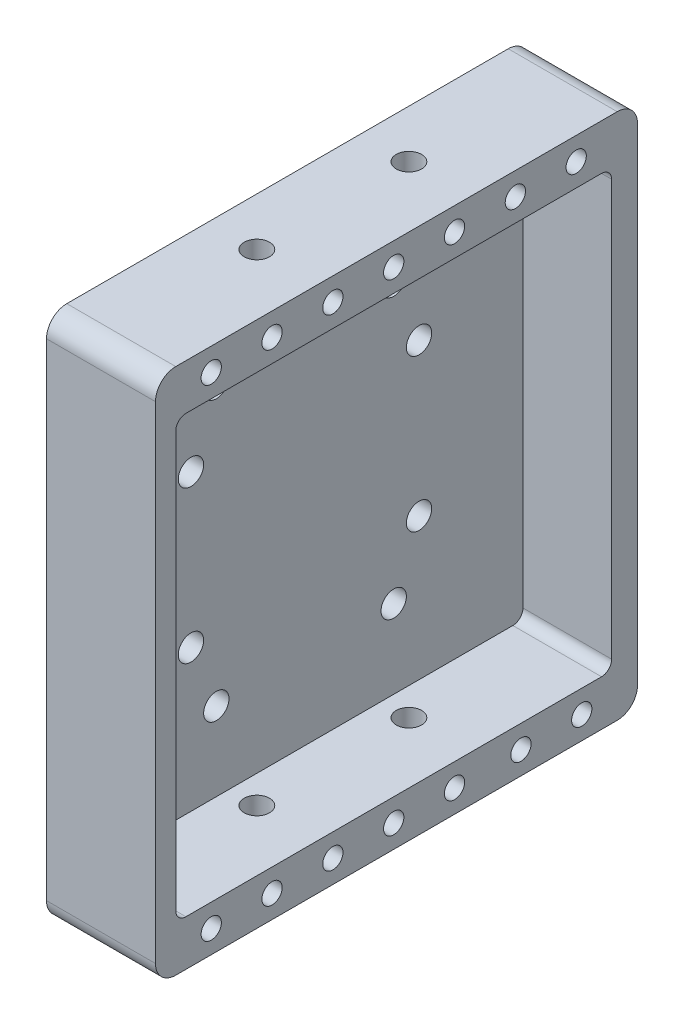
from build123d import *

# Parameters (mm, degrees)
SKETCH_1_W                = 104
SKETCH_1_H                = 95.096423431
EXTRUDE_1_DEPTH           = 21.5
SKETCH_2_W                = 86
SKETCH_2_H                = 86
CUT_EXTRUDE_1_DEPTH       = 17.5
HOLE_WIZARD_4_0_4_1_D     = 4
HOLE_WIZARD_4_0_4_1_DEPTH = 8
HOLE_WIZARD_5_0_5_1_D     = 5
HOLE_WIZARD_5_0_5_1_DEPTH = 9
HOLE_WIZARD_5_0_5_2_D     = 5
HOLE_WIZARD_5_0_5_2_DEPTH = 21.5
HOLE_WIZARD_5_0_5_3_D     = 5
HOLE_WIZARD_5_0_5_3_DEPTH = 104
FILLET_1_R                = 2
FILLET_2_R                = 4


with BuildPart() as part:
    # 草图1 → 凸台-拉伸1 (new body)
    with BuildSketch(Plane(origin=(0, 0, 0), x_dir=(0, -1, 0), z_dir=(-1, 0, 0))):
        with Locations((0, -0.548211716)):
            Rectangle(SKETCH_1_W, SKETCH_1_H)
    extrude(amount=-EXTRUDE_1_DEPTH)

    # 草图2 → 切除-拉伸1 (cut)
    with BuildSketch(Plane(origin=(21.5, 0, 0), x_dir=(0, 0, -1), z_dir=(1, 0, 0))):
        Rectangle(SKETCH_2_W, SKETCH_2_H)
    extrude(amount=-CUT_EXTRUDE_1_DEPTH, mode=Mode.SUBTRACT)

    # Ø4.0 (4) 直径孔1
    with Locations(Plane(origin=(21.5, 0, 0), x_dir=(0, 0, -1), z_dir=(1, 0, 0))):
        with Locations((0, 47.5), (12, 47.5), (24, 47.5), (-12, 47.5), (-24, 47.5), (0, -47.5), (12, -47.5), (25.096423431, -47.5), (-12, -47.5), (-24, -47.5), (36, 47.5), (37.096423431, -47.5), (-36, -47.5), (-36, 47.5)):
            Hole(HOLE_WIZARD_4_0_4_1_D / 2, depth=HOLE_WIZARD_4_0_4_1_DEPTH)

    # Ø5.0 (5) 直径孔1
    with Locations(Plane(origin=(0, -52, 0), x_dir=(-1, 0, 0), z_dir=(0, -1, 0))):
        with Locations((-9.5, 15), (-9.5, -15)):
            Hole(HOLE_WIZARD_5_0_5_1_D / 2, depth=HOLE_WIZARD_5_0_5_1_DEPTH)

    # Ø5.0 (5) 直径孔2
    with Locations(Plane.ZY):
        with Locations((-17.5, -27.5), (-17.5, 27.5), (17.5, 27.5), (17.5, -27.5), (-22.5, -15), (-22.5, 15), (22.5, 15), (22.5, -15)):
            Hole(HOLE_WIZARD_5_0_5_2_D / 2, depth=HOLE_WIZARD_5_0_5_2_DEPTH)

    # Ø5.0 (5) 直径孔3
    with Locations(Plane(origin=(0, 52, 0), x_dir=(1, 0, 0), z_dir=(0, 1, 0))):
        with Locations((9.5, -15), (9.5, 15)):
            Hole(HOLE_WIZARD_5_0_5_3_D / 2, depth=HOLE_WIZARD_5_0_5_3_DEPTH)

    # 圆角1
    fillet_1_edges = [part.edges().sort_by_distance(p)[0] for p in [
        (12.75, -43, -43),
        (12.75, -43, 43),
        (12.75, 43, 43),
        (12.75, 43, -43),
    ]]
    fillet(fillet_1_edges, radius=FILLET_1_R)

    # 圆角2
    fillet_2_edges = [part.edges().sort_by_distance(p)[0] for p in [
        (10.75, -52, 47),
        (10.75, -52, -48.096423431),
        (10.75, 52, -48.096423431),
        (10.75, 52, 47),
    ]]
    fillet(fillet_2_edges, radius=FILLET_2_R)


solid = part.part
